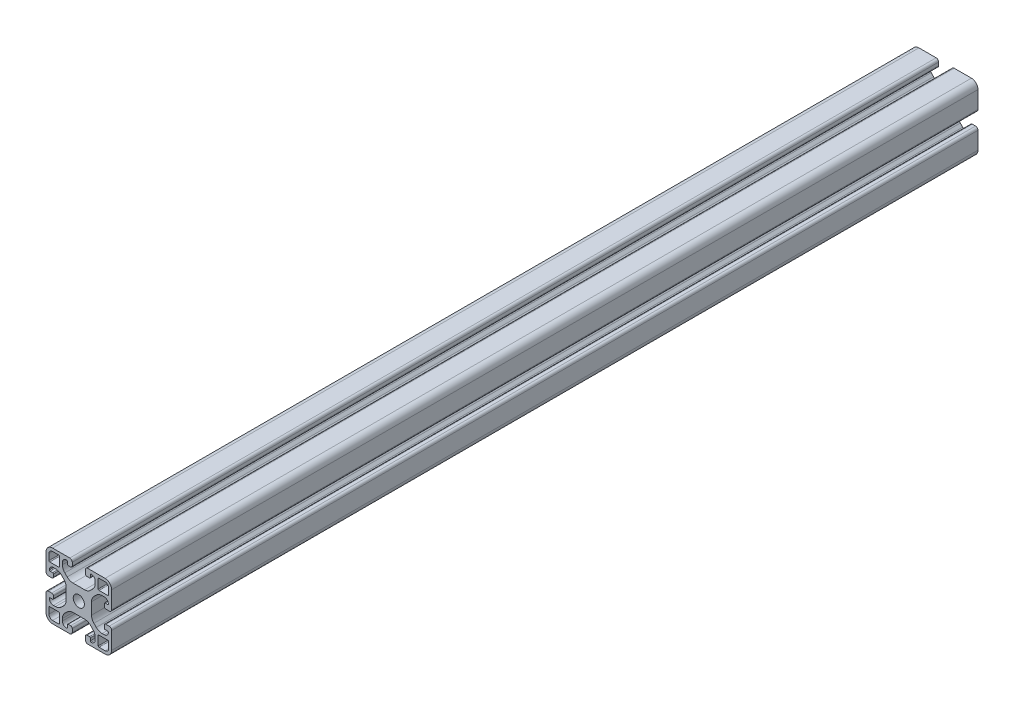
from build123d import *

# Parameters (mm, degrees)
ESQUISSE1_R        = 3.4
BOSS_EXTRU_1_DEPTH = 528


with BuildPart() as part:
    # Esquisse1 → Boss.-Extru.1 (new body)
    with BuildSketch(Plane(origin=(0, 0, -30), x_dir=(-1, 0, 0), z_dir=(0, 0, -1))):
        with BuildLine():
            Line((-4.5, 15), (-4.5, 13.5))
            ThreePointArc((-4.5, 13.5), (-4.353553391, 13.146446609), (-4, 13))
            Line((-4, 13), (-2.5, 13))
            ThreePointArc((-2.5, 13), (-2.146446609, 12.853553391), (-2, 12.5))
            ThreePointArc((-2, 12.5), (-2.732233047, 10.732233047), (-4.5, 10))
            Line((-4.5, 10), (-5.807611845, 10))
            ThreePointArc((-5.807611845, 10), (-7.721029006, 10.380602337), (-9.343145751, 11.464466094))
            Line((-9.343145751, 11.464466094), (-10.785533906, 12.906854249))
            ThreePointArc((-10.785533906, 12.906854249), (-11.869397663, 14.528970994), (-12.25, 16.442388155))
            Line((-12.25, 16.442388155), (-12.25, 23.557611845))
            ThreePointArc((-12.25, 23.557611845), (-11.869397663, 25.471029006), (-10.785533906, 27.093145751))
            Line((-10.785533906, 27.093145751), (-9.343145751, 28.535533906))
            ThreePointArc((-9.343145751, 28.535533906), (-7.721029006, 29.619397663), (-5.807611845, 30))
            Line((-5.807611845, 30), (-4.5, 30))
            ThreePointArc((-4.5, 30), (-2.732233047, 29.267766953), (-2, 27.5))
            ThreePointArc((-2, 27.5), (-2.146446609, 27.146446609), (-2.5, 27))
            Line((-2.5, 27), (-4, 27))
            ThreePointArc((-4, 27), (-4.353553391, 26.853553391), (-4.5, 26.5))
            Line((-4.5, 26.5), (-4.5, 25))
            ThreePointArc((-4.5, 25), (-4.207106781, 24.292893219), (-3.5, 24))
            Line((-3.5, 24), (-1.5, 24))
            ThreePointArc((-1.5, 24), (-0.439339828, 24.439339828), (0, 25.5))
            Line((0, 25.5), (0, 36))
            ThreePointArc((0, 36), (-1.171572875, 38.828427125), (-4, 40))
            Line((-4, 40), (-14.5, 40))
            ThreePointArc((-14.5, 40), (-15.560660172, 39.560660172), (-16, 38.5))
            Line((-16, 38.5), (-16, 36.5))
            ThreePointArc((-16, 36.5), (-15.707106781, 35.792893219), (-15, 35.5))
            Line((-15, 35.5), (-13.5, 35.5))
            ThreePointArc((-13.5, 35.5), (-13.146446609, 35.646446609), (-13, 36))
            Line((-13, 36), (-13, 37.5))
            ThreePointArc((-13, 37.5), (-12.853553391, 37.853553391), (-12.5, 38))
            ThreePointArc((-12.5, 38), (-10.732233047, 37.267766953), (-10, 35.5))
            Line((-10, 35.5), (-10, 34.192388155))
            ThreePointArc((-10, 34.192388155), (-10.380602337, 32.278970994), (-11.464466094, 30.656854249))
            Line((-11.464466094, 30.656854249), (-12.906854249, 29.214466094))
            ThreePointArc((-12.906854249, 29.214466094), (-14.528970994, 28.130602337), (-16.442388155, 27.75))
            Line((-16.442388155, 27.75), (-23.557611845, 27.75))
            ThreePointArc((-23.557611845, 27.75), (-25.471029006, 28.130602337), (-27.093145751, 29.214466094))
            Line((-27.093145751, 29.214466094), (-28.535533906, 30.656854249))
            ThreePointArc((-28.535533906, 30.656854249), (-29.619397663, 32.278970994), (-30, 34.192388155))
            Line((-30, 34.192388155), (-30, 35.5))
            ThreePointArc((-30, 35.5), (-29.267766953, 37.267766953), (-27.5, 38))
            ThreePointArc((-27.5, 38), (-27.146446609, 37.853553391), (-27, 37.5))
            Line((-27, 37.5), (-27, 36))
            ThreePointArc((-27, 36), (-26.853553391, 35.646446609), (-26.5, 35.5))
            Line((-26.5, 35.5), (-25, 35.5))
            ThreePointArc((-25, 35.5), (-24.292893219, 35.792893219), (-24, 36.5))
            Line((-24, 36.5), (-24, 38.5))
            ThreePointArc((-24, 38.5), (-24.439339828, 39.560660172), (-25.5, 40))
            Line((-25.5, 40), (-36, 40))
            ThreePointArc((-36, 40), (-38.828427125, 38.828427125), (-40, 36))
            Line((-40, 36), (-40, 25.5))
            ThreePointArc((-40, 25.5), (-39.560660172, 24.439339828), (-38.5, 24))
            Line((-38.5, 24), (-36.5, 24))
            ThreePointArc((-36.5, 24), (-35.792893219, 24.292893219), (-35.5, 25))
            Line((-35.5, 25), (-35.5, 26.5))
            ThreePointArc((-35.5, 26.5), (-35.646446609, 26.853553391), (-36, 27))
            Line((-36, 27), (-37.5, 27))
            ThreePointArc((-37.5, 27), (-37.853553391, 27.146446609), (-38, 27.5))
            ThreePointArc((-38, 27.5), (-37.267766953, 29.267766953), (-35.5, 30))
            Line((-35.5, 30), (-34.192388155, 30))
            ThreePointArc((-34.192388155, 30), (-32.278970994, 29.619397663), (-30.656854249, 28.535533906))
            Line((-30.656854249, 28.535533906), (-29.214466094, 27.093145751))
            ThreePointArc((-29.214466094, 27.093145751), (-28.130602337, 25.471029006), (-27.75, 23.557611845))
            Line((-27.75, 23.557611845), (-27.75, 16.442388155))
            ThreePointArc((-27.75, 16.442388155), (-28.130602337, 14.528970994), (-29.214466094, 12.906854249))
            Line((-29.214466094, 12.906854249), (-30.656854249, 11.464466094))
            ThreePointArc((-30.656854249, 11.464466094), (-32.278970994, 10.380602337), (-34.192388155, 10))
            Line((-34.192388155, 10), (-35.5, 10))
            ThreePointArc((-35.5, 10), (-37.267766953, 10.732233047), (-38, 12.5))
            ThreePointArc((-38, 12.5), (-37.853553391, 12.853553391), (-37.5, 13))
            Line((-37.5, 13), (-36, 13))
            ThreePointArc((-36, 13), (-35.646446609, 13.146446609), (-35.5, 13.5))
            Line((-35.5, 13.5), (-35.5, 15))
            ThreePointArc((-35.5, 15), (-35.792893219, 15.707106781), (-36.5, 16))
            Line((-36.5, 16), (-38.5, 16))
            ThreePointArc((-38.5, 16), (-39.560660172, 15.560660172), (-40, 14.5))
            Line((-40, 14.5), (-40, 4))
            ThreePointArc((-40, 4), (-38.828427125, 1.171572875), (-36, 0))
            Line((-36, 0), (-25.5, 0))
            ThreePointArc((-25.5, 0), (-24.439339828, 0.439339828), (-24, 1.5))
            Line((-24, 1.5), (-24, 3.5))
            ThreePointArc((-24, 3.5), (-24.292893219, 4.207106781), (-25, 4.5))
            Line((-25, 4.5), (-26.5, 4.5))
            ThreePointArc((-26.5, 4.5), (-26.853553391, 4.353553391), (-27, 4))
            Line((-27, 4), (-27, 2.5))
            ThreePointArc((-27, 2.5), (-27.146446609, 2.146446609), (-27.5, 2))
            ThreePointArc((-27.5, 2), (-29.267766953, 2.732233047), (-30, 4.5))
            Line((-30, 4.5), (-30, 5.807611845))
            ThreePointArc((-30, 5.807611845), (-29.619397663, 7.721029006), (-28.535533906, 9.343145751))
            Line((-28.535533906, 9.343145751), (-27.093145751, 10.785533906))
            ThreePointArc((-27.093145751, 10.785533906), (-25.471029006, 11.869397663), (-23.557611845, 12.25))
            Line((-23.557611845, 12.25), (-16.442388155, 12.25))
            ThreePointArc((-16.442388155, 12.25), (-14.528970994, 11.869397663), (-12.906854249, 10.785533906))
            Line((-12.906854249, 10.785533906), (-11.464466094, 9.343145751))
            ThreePointArc((-11.464466094, 9.343145751), (-10.380602337, 7.721029006), (-10, 5.807611845))
            Line((-10, 5.807611845), (-10, 4.5))
            ThreePointArc((-10, 4.5), (-10.732233047, 2.732233047), (-12.5, 2))
            ThreePointArc((-12.5, 2), (-12.853553391, 2.146446609), (-13, 2.5))
            Line((-13, 2.5), (-13, 4))
            ThreePointArc((-13, 4), (-13.146446609, 4.353553391), (-13.5, 4.5))
            Line((-13.5, 4.5), (-15, 4.5))
            ThreePointArc((-15, 4.5), (-15.707106781, 4.207106781), (-16, 3.5))
            Line((-16, 3.5), (-16, 1.5))
            ThreePointArc((-16, 1.5), (-15.560660172, 0.439339828), (-14.5, 0))
            Line((-14.5, 0), (-4, 0))
            ThreePointArc((-4, 0), (-1.171572875, 1.171572875), (0, 4))
            Line((0, 4), (0, 14.5))
            ThreePointArc((0, 14.5), (-0.439339828, 15.560660172), (-1.5, 16))
            Line((-1.5, 16), (-3.5, 16))
            ThreePointArc((-3.5, 16), (-4.207106781, 15.707106781), (-4.5, 15))
        make_face()
        with Locations(Location((-20, 20, 0), (0, 0, 180))):
            Circle(ESQUISSE1_R, mode=Mode.SUBTRACT)
        with BuildLine():
            Line((-4, 1.8), (-7.7, 1.8))
            ThreePointArc((-7.7, 1.8), (-8.053553391, 1.946446609), (-8.2, 2.3))
            Line((-8.2, 2.3), (-8.2, 7.7))
            ThreePointArc((-8.2, 7.7), (-8.053553391, 8.053553391), (-7.7, 8.2))
            Line((-7.7, 8.2), (-2.3, 8.2))
            ThreePointArc((-2.3, 8.2), (-1.946446609, 8.053553391), (-1.8, 7.7))
            Line((-1.8, 7.7), (-1.8, 4))
            ThreePointArc((-1.8, 4), (-2.444365081, 2.444365081), (-4, 1.8))
        make_face(mode=Mode.SUBTRACT)
        with BuildLine():
            Line((-38.2, 4), (-38.2, 7.7))
            ThreePointArc((-38.2, 7.7), (-38.053553391, 8.053553391), (-37.7, 8.2))
            Line((-37.7, 8.2), (-32.3, 8.2))
            ThreePointArc((-32.3, 8.2), (-31.946446609, 8.053553391), (-31.8, 7.7))
            Line((-31.8, 7.7), (-31.8, 2.3))
            ThreePointArc((-31.8, 2.3), (-31.946446609, 1.946446609), (-32.3, 1.8))
            Line((-32.3, 1.8), (-36, 1.8))
            ThreePointArc((-36, 1.8), (-37.555634919, 2.444365081), (-38.2, 4))
        make_face(mode=Mode.SUBTRACT)
        with BuildLine():
            Line((-36, 38.2), (-32.3, 38.2))
            ThreePointArc((-32.3, 38.2), (-31.946446609, 38.053553391), (-31.8, 37.7))
            Line((-31.8, 37.7), (-31.8, 32.3))
            ThreePointArc((-31.8, 32.3), (-31.946446609, 31.946446609), (-32.3, 31.8))
            Line((-32.3, 31.8), (-37.7, 31.8))
            ThreePointArc((-37.7, 31.8), (-38.053553391, 31.946446609), (-38.2, 32.3))
            Line((-38.2, 32.3), (-38.2, 36))
            ThreePointArc((-38.2, 36), (-37.555634919, 37.555634919), (-36, 38.2))
        make_face(mode=Mode.SUBTRACT)
        with BuildLine():
            Line((-1.8, 36), (-1.8, 32.3))
            ThreePointArc((-1.8, 32.3), (-1.946446609, 31.946446609), (-2.3, 31.8))
            Line((-2.3, 31.8), (-7.7, 31.8))
            ThreePointArc((-7.7, 31.8), (-8.053553391, 31.946446609), (-8.2, 32.3))
            Line((-8.2, 32.3), (-8.2, 37.7))
            ThreePointArc((-8.2, 37.7), (-8.053553391, 38.053553391), (-7.7, 38.2))
            Line((-7.7, 38.2), (-4, 38.2))
            ThreePointArc((-4, 38.2), (-2.444365081, 37.555634919), (-1.8, 36))
        make_face(mode=Mode.SUBTRACT)
    extrude(amount=-BOSS_EXTRU_1_DEPTH)


solid = part.part
